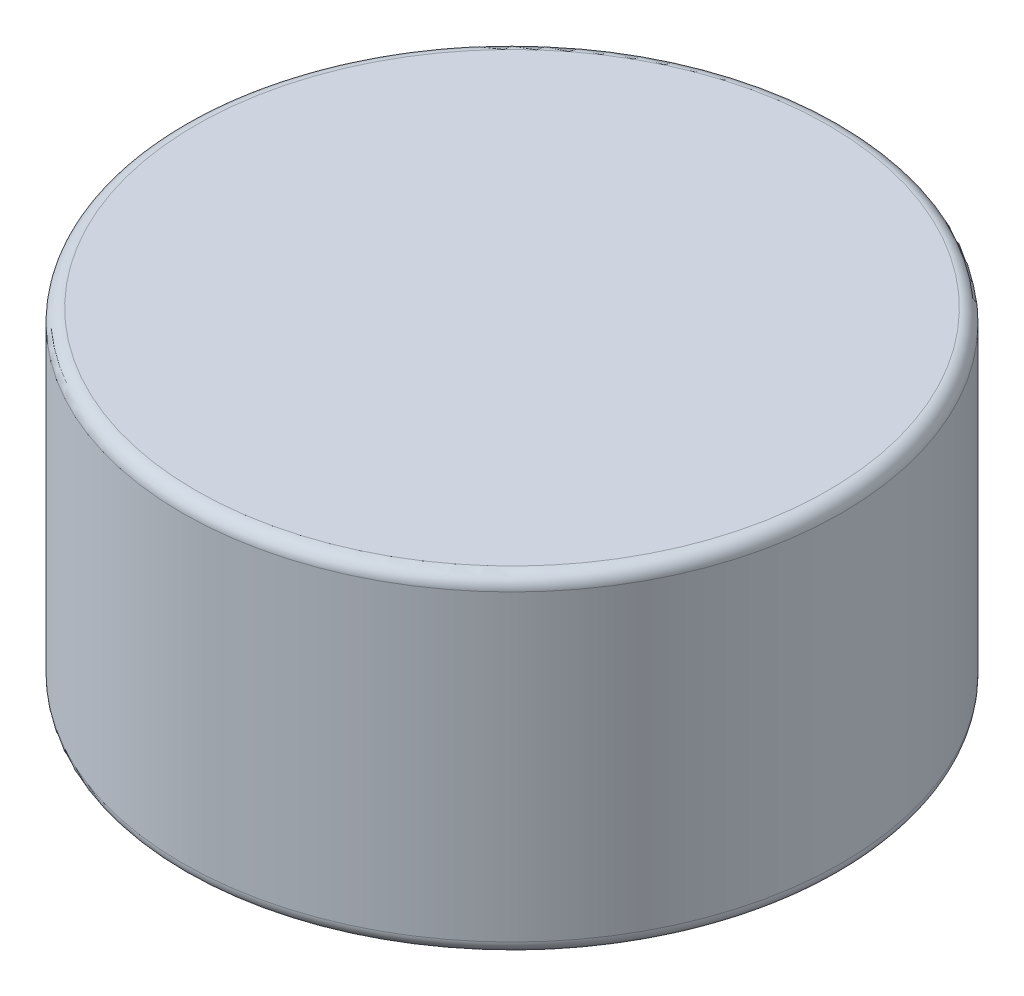
from build123d import *

# Parameters (mm, degrees)
SKETCH1_R           = 3.175
BOSS_EXTRUDE1_DEPTH = 1.5875
FILLET1_R           = 0.127


with BuildPart() as part:
    # Sketch1 → Boss-Extrude1 (new, symmetric)
    with BuildSketch(Plane(origin=(0, 0, 0), x_dir=(1, 0, 0), z_dir=(0, 1, 0))):
        with Locations(Location((0, 0, 0), (0, 0, 270))):
            Circle(SKETCH1_R)
    extrude(amount=BOSS_EXTRUDE1_DEPTH, both=True)

    # Fillet1
    fillet1_edges = [part.edges().sort_by_distance(p)[0] for p in [
        (0, -1.5875, -3.175),
        (0, 1.5875, -3.175),
    ]]
    fillet(fillet1_edges, radius=FILLET1_R)


solid = part.part
